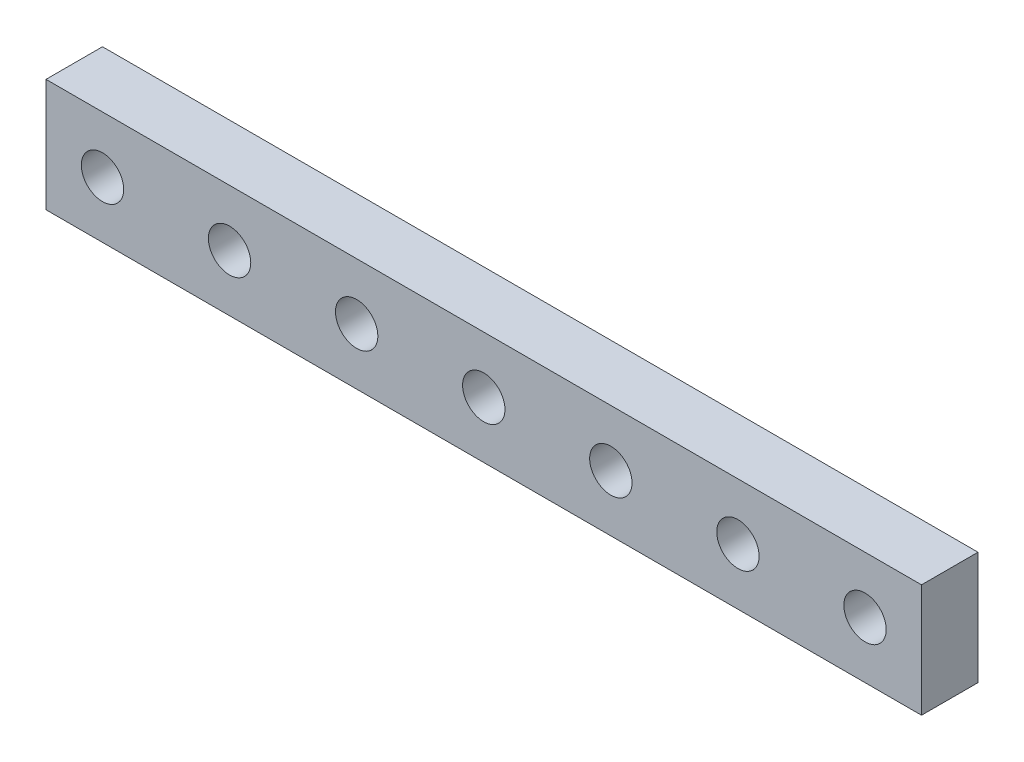
from build123d import *

# Parameters (mm, degrees)
SKETCH_1_W      = 62
SKETCH_1_H      = 8
SKETCH_1_R      = 1.5
EXTRUDE_1_DEPTH = 4


with BuildPart() as part:
    # 草图1 → 凸台-拉伸1 (new body)
    with BuildSketch(Plane.XY):
        with Locations((2582.341808549, 1592.067691538)):
            Rectangle(SKETCH_1_W, SKETCH_1_H)
        with Locations((2555.341808549, 1592.067691538)):
            Circle(SKETCH_1_R, mode=Mode.SUBTRACT)
        with Locations((2564.341808549, 1592.067691538)):
            Circle(SKETCH_1_R, mode=Mode.SUBTRACT)
        with Locations((2573.341808549, 1592.067691538)):
            Circle(SKETCH_1_R, mode=Mode.SUBTRACT)
        with Locations((2582.341808549, 1592.067691538)):
            Circle(SKETCH_1_R, mode=Mode.SUBTRACT)
        with Locations((2591.341808549, 1592.067691538)):
            Circle(SKETCH_1_R, mode=Mode.SUBTRACT)
        with Locations((2600.341808549, 1592.067691538)):
            Circle(SKETCH_1_R, mode=Mode.SUBTRACT)
        with Locations((2609.341808549, 1592.067691538)):
            Circle(SKETCH_1_R, mode=Mode.SUBTRACT)
    extrude(amount=EXTRUDE_1_DEPTH)


solid = part.part
